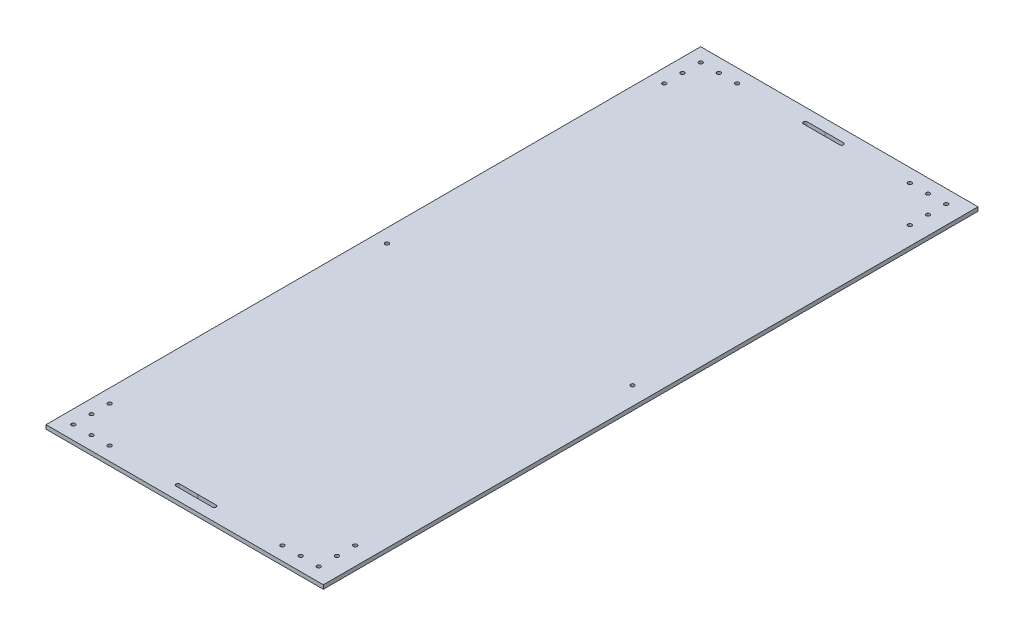
from build123d import *

# Parameters (mm, degrees)
SKETCH1_W                  = 609.6
SKETCH1_H                  = 1219.2
BOSS_EXTRUDE1_DEPTH        = 5.5
BOSS_EXTRUDE2_DEPTH        = 6.35
F_5_3_5_3_DIAMETER_HOLE1_D = 5.3
CUT_EXTRUDE1_REACH         = 1365.159
CUT_EXTRUDE2_DEPTH         = 994.074837311


with BuildPart() as part:
    # Sketch1 → Boss-Extrude1 (new body)
    with BuildSketch(Plane(origin=(0, 0, 0), x_dir=(1, 0, 0), z_dir=(0, 1, 0))):
        with Locations((304.8, 609.6)):
            Rectangle(SKETCH1_W, SKETCH1_H)
    extrude(amount=BOSS_EXTRUDE1_DEPTH)

    # Sketch3 → Boss-Extrude2 (add)
    with BuildSketch(Plane(origin=(0, 5.5, 0), x_dir=(1, 0, 0), z_dir=(0, 1, 0))):
        Polygon((387.35, 0), (387.35, 914.4), (0, 914.4), (0, 1219.2), (609.6, 1219.2), (609.6, 0), align=None)
    extrude(amount=BOSS_EXTRUDE2_DEPTH)

    # Ø5.3 (5.3) Diameter Hole1 (through all)
    with Locations(Plane(origin=(0, 5.5, 0), x_dir=(1, 0, 0), z_dir=(0, 1, 0))):
        with Locations((19.05, 895.35), (44.45, 895.35), (69.85, 895.35), (19.05, 869.95), (19.05, 844.55), (19.05, 457.2), (19.05, 69.85), (19.05, 44.45), (19.05, 19.05), (44.45, 19.05), (69.85, 19.05), (190.5, 19.05), (311.15, 19.05), (336.55, 19.05), (361.95, 19.05), (361.95, 44.45), (361.95, 69.85), (361.95, 457.2), (361.95, 844.55), (361.95, 869.95), (361.95, 895.35), (336.55, 895.35), (311.15, 895.35), (190.5, 895.35)):
            Hole(F_5_3_5_3_DIAMETER_HOLE1_D / 2)

    # Sketch7 → Cut-Extrude1 (cut, up to next)
    with BuildSketch(Plane(origin=(0, 11.85, 0), x_dir=(1, 0, 0), z_dir=(0, 1, 0)), mode=Mode.PRIVATE) as cut_extrude1_sk1:
        Polygon((0, 1219.2), (0, 914.4), (387.35, 914.4), (387.35, 0), (609.6, 0), (609.6, 1219.2), align=None)
    cut_extrude1_tool1 = extrude(cut_extrude1_sk1.sketch, amount=-CUT_EXTRUDE1_REACH, mode=Mode.PRIVATE) & part.part
    add(cut_extrude1_tool1.solids().sort_by_distance((405.973507, 11.85, -748.352239))[0], mode=Mode.SUBTRACT)

    # Sketch8 → Cut-Extrude2 (cut, through all)
    with BuildSketch(Plane(origin=(0, 5.5, 0), x_dir=(1, 0, 0), z_dir=(0, 1, 0))):
        with BuildLine():
            ThreePointArc((189.987652462, 16.45), (187.85, 19.05), (189.987652462, 21.65))
            Line((189.987652462, 21.65), (165.1, 21.65))
            ThreePointArc((165.1, 21.65), (162.5, 19.05), (165.1, 16.45))
            Line((165.1, 16.45), (189.987652462, 16.45))
        make_face()
        with BuildLine():
            ThreePointArc((190.5, 21.65), (187.9, 19.05), (190.5, 16.45))
            ThreePointArc((190.5, 16.45), (193.1, 19.05), (190.5, 21.65))
        make_face()
        with BuildLine():
            Line((215.9, 21.65), (191.012347538, 21.65))
            ThreePointArc((191.012347538, 21.65), (192.546975937, 20.732970443), (193.15, 19.05))
            ThreePointArc((193.15, 19.05), (192.546975937, 17.367029557), (191.012347538, 16.45))
            Line((191.012347538, 16.45), (215.9, 16.45))
            ThreePointArc((215.9, 16.45), (218.5, 19.05), (215.9, 21.65))
        make_face()
        with BuildLine():
            ThreePointArc((165.1, 897.95), (162.5, 895.35), (165.1, 892.75))
            Line((165.1, 892.75), (189.987652462, 892.75))
            ThreePointArc((189.987652462, 892.75), (187.85, 895.35), (189.987652462, 897.95))
            Line((189.987652462, 897.95), (165.1, 897.95))
        make_face()
        with BuildLine():
            ThreePointArc((190.5, 892.75), (187.9, 895.35), (190.5, 897.95))
            ThreePointArc((190.5, 897.95), (193.1, 895.35), (190.5, 892.75))
        make_face()
        with BuildLine():
            ThreePointArc((193.15, 895.35), (192.546975937, 893.667029557), (191.012347538, 892.75))
            Line((191.012347538, 892.75), (215.9, 892.75))
            ThreePointArc((215.9, 892.75), (218.5, 895.35), (215.9, 897.95))
            Line((215.9, 897.95), (191.012347538, 897.95))
            ThreePointArc((191.012347538, 897.95), (192.546975937, 897.032970443), (193.15, 895.35))
        make_face()
    extrude(amount=-CUT_EXTRUDE2_DEPTH, mode=Mode.SUBTRACT)


solid = part.part
